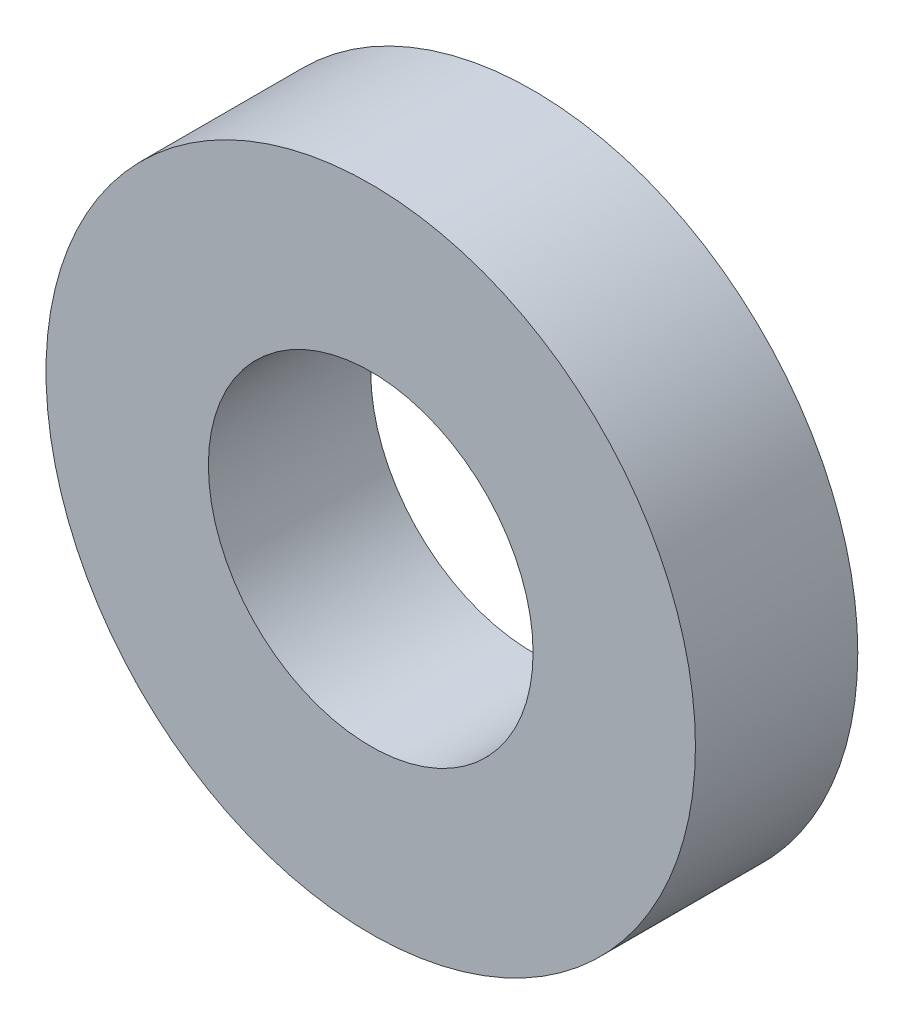
from build123d import *

# Parameters (mm, degrees)
SKETCH1_R           = 6
SKETCH1_R_2         = 3
BOSS_EXTRUDE1_DEPTH = 3


with BuildPart() as part:
    # Sketch1 → Boss-Extrude1 (new body)
    with BuildSketch(Plane.XY):
        Circle(SKETCH1_R)
        Circle(SKETCH1_R_2, mode=Mode.SUBTRACT)
    extrude(amount=BOSS_EXTRUDE1_DEPTH)


solid = part.part
